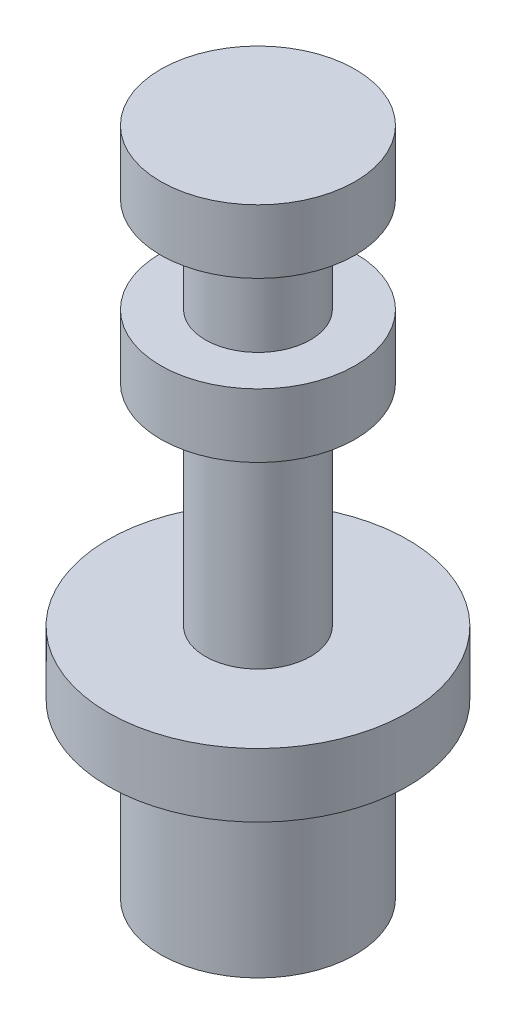
from build123d import *

# Parameters (mm, degrees)
CROQUIS2_R              = 0.7747
SALIENTE_EXTRUIR1_DEPTH = 1.3716
CROQUIS3_R              = 1.1938
SALIENTE_EXTRUIR2_DEPTH = 0.508
CROQUIS4_R              = 0.4191
SALIENTE_EXTRUIR3_DEPTH = 1.6764
CROQUIS5_R              = 0.7747
SALIENTE_EXTRUIR4_DEPTH = 0.508
CROQUIS6_R              = 0.4191
SALIENTE_EXTRUIR5_DEPTH = 0.762
CROQUIS7_R              = 0.7747
SALIENTE_EXTRUIR6_DEPTH = 0.508


with BuildPart() as part:
    # Croquis2 → Saliente-Extruir1 (new body)
    with BuildSketch(Plane(origin=(0, 0, 0), x_dir=(1, 0, 0), z_dir=(0, 1, 0))):
        with Locations(Location((0, 0, 0), (0, 0, 270))):
            Circle(CROQUIS2_R)
    extrude(amount=SALIENTE_EXTRUIR1_DEPTH)

    # Croquis3 → Saliente-Extruir2 (add)
    with BuildSketch(Plane(origin=(0, 1.3716, 0), x_dir=(1, 0, 0), z_dir=(0, 1, 0))):
        with Locations(Location((0, 0, 0), (0, 0, 270))):
            Circle(CROQUIS3_R)
    extrude(amount=SALIENTE_EXTRUIR2_DEPTH)

    # Croquis4 → Saliente-Extruir3 (add)
    with BuildSketch(Plane(origin=(0, 1.8796, 0), x_dir=(1, 0, 0), z_dir=(0, 1, 0))):
        with Locations(Location((0, 0, 0), (0, 0, 270))):
            Circle(CROQUIS4_R)
    extrude(amount=SALIENTE_EXTRUIR3_DEPTH)

    # Croquis5 → Saliente-Extruir4 (add)
    with BuildSketch(Plane(origin=(0, 3.556, 0), x_dir=(1, 0, 0), z_dir=(0, 1, 0))):
        with Locations(Location((0, 0, 0), (0, 0, 270))):
            Circle(CROQUIS5_R)
    extrude(amount=SALIENTE_EXTRUIR4_DEPTH)

    # Croquis6 → Saliente-Extruir5 (add)
    with BuildSketch(Plane(origin=(0, 4.064, 0), x_dir=(1, 0, 0), z_dir=(0, 1, 0))):
        with Locations(Location((0, 0, 0), (0, 0, 270))):
            Circle(CROQUIS6_R)
    extrude(amount=SALIENTE_EXTRUIR5_DEPTH)

    # Croquis7 → Saliente-Extruir6 (add)
    with BuildSketch(Plane(origin=(0, 4.826, 0), x_dir=(1, 0, 0), z_dir=(0, 1, 0))):
        with Locations(Location((0, 0, 0), (0, 0, 270))):
            Circle(CROQUIS7_R)
    extrude(amount=SALIENTE_EXTRUIR6_DEPTH)


solid = part.part
